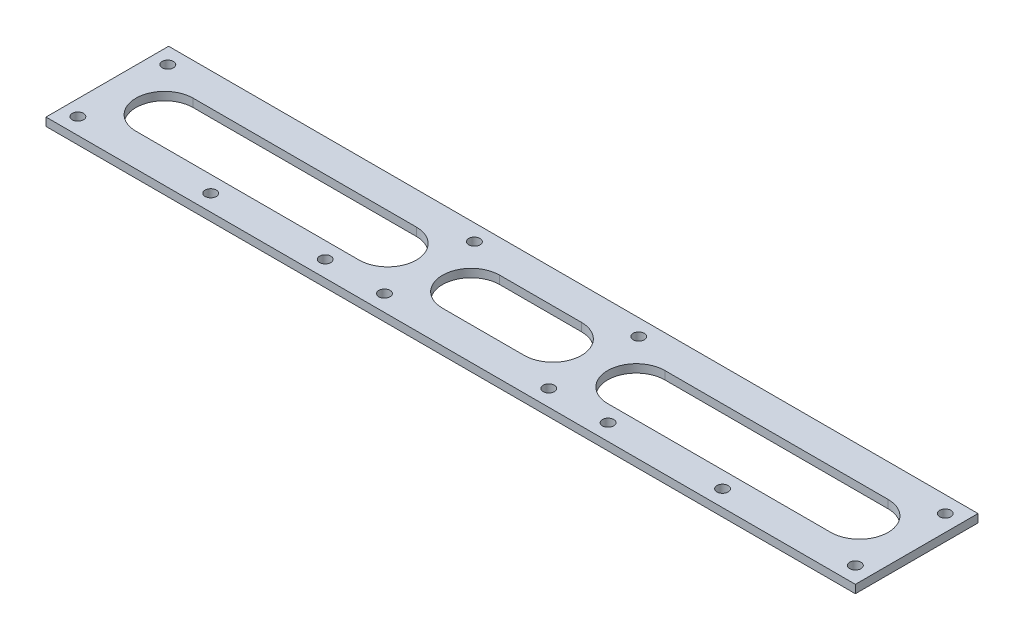
from build123d import *

# Parameters (mm, degrees)
SKETCH_1_W               = 198
SKETCH_1_H               = 30
EXTRUDE_1_DEPTH          = 2
HOLE_WIZARD_1_D          = 2.75
HOLE_WIZARD_1_DEPTH      = 100
CUT_EXTRUDE_1_DEPTH      = 101.149887668
CUT_EXTRUDE_1_DEPTH_BACK = 101.149887668


with BuildPart() as part:
    # 草图1 → 凸台-拉伸1 (new body)
    with BuildSketch(Plane(origin=(0, 0, 0), x_dir=(1, 0, 0), z_dir=(0, 1, 0))):
        Rectangle(SKETCH_1_W, SKETCH_1_H)
    extrude(amount=EXTRUDE_1_DEPTH)

    # 孔1
    with Locations(Plane(origin=(0, 2, 0), x_dir=(1, 0, 0), z_dir=(0, 1, 0))):
        with Locations((95, 10.999999819), (95, -11), (20.000000003, 10.999999819), (20.000000003, -11), (-95.2, 10.999999819), (-95.2, -11), (-20.200000003, 10.999999819), (-20.200000003, -11), (-34.700003407, -11), (-62.700003407, -11), (62.500003407, -11), (34.500003407, -11)):
            Hole(HOLE_WIZARD_1_D / 2, depth=HOLE_WIZARD_1_DEPTH)

    # 草图4 → 切除-拉伸1 (cut, two sides: drawn at the far end of the back side and taken through both)
    with BuildSketch(Plane(origin=(0, 2, 0), x_dir=(1, 0, 0), z_dir=(0, 1, 0)).offset(-CUT_EXTRUDE_1_DEPTH_BACK)):
        with BuildLine():
            Line((-10, 7), (10, 7))
            ThreePointArc((10, 7), (17, 0), (10, -7))
            Line((10, -7), (-10, -7))
            ThreePointArc((-10, -7), (-17, 0), (-10, 7))
        make_face()
        with BuildLine():
            Line((-84.999999997, 7), (-30.400000007, 7))
            ThreePointArc((-30.400000007, 7), (-23.400000007, 0), (-30.400000007, -7))
            Line((-30.400000007, -7), (-84.999999997, -7))
            ThreePointArc((-84.999999997, -7), (-91.999999997, 0), (-84.999999997, 7))
        make_face()
        with BuildLine():
            Line((84.999999997, 7), (30.400000007, 7))
            ThreePointArc((30.400000007, 7), (23.400000007, 0), (30.400000007, -7))
            Line((30.400000007, -7), (84.999999997, -7))
            ThreePointArc((84.999999997, -7), (91.999999997, 0), (84.999999997, 7))
        make_face()
    extrude(amount=CUT_EXTRUDE_1_DEPTH + CUT_EXTRUDE_1_DEPTH_BACK, mode=Mode.SUBTRACT)


solid = part.part
